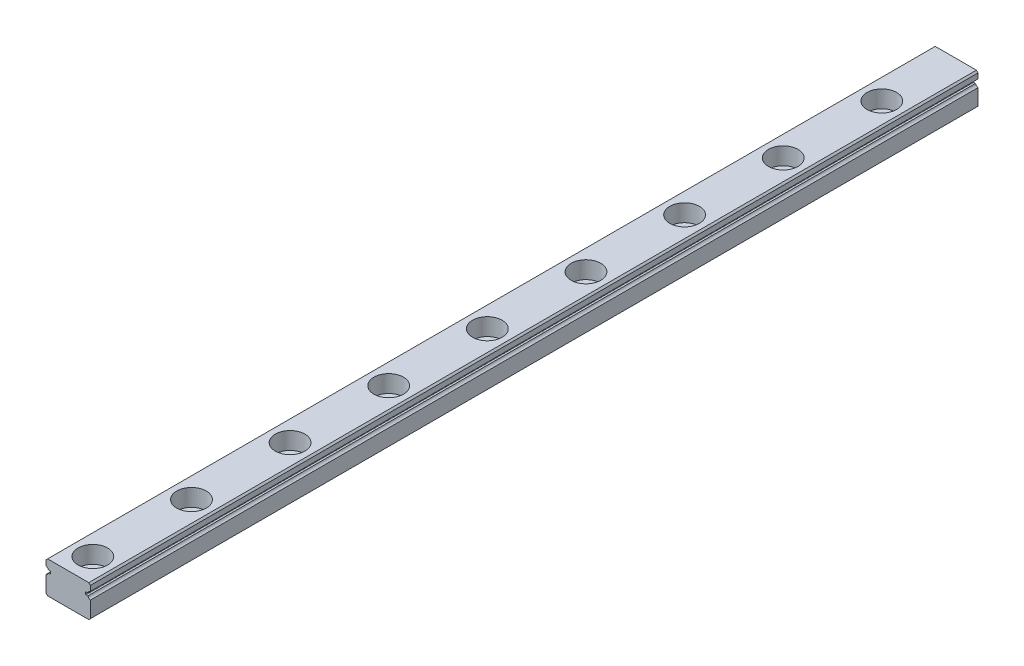
from build123d import *

# Parameters (mm, degrees)
EXTRUDE_1_DEPTH              = 180
HOLE_WIZARD_M2_1_D           = 2.4
HOLE_WIZARD_M2_1_CBORE_D     = 6
HOLE_WIZARD_M2_1_CBORE_DEPTH = 3.5
PATTERN_LINEAR_1_COUNT       = 9
PATTERN_LINEAR_1_PITCH       = 20


with BuildPart() as part:
    # 草图1 → 凸台-拉伸1 (new body)
    with BuildSketch(Plane.XY):
        with BuildLine():
            Line((-4.5, -2.905269119), (-4.5, -6.175269119))
            Line((-4.5, -6.175269119), (-4.174730881, -6.500538239))
            Line((-4.174730881, -6.500538239), (0, -6.500538239))
            Line((0, -6.500538239), (4.174730881, -6.500538239))
            Line((4.174730881, -6.500538239), (4.5, -6.175269119))
            Line((4.5, -6.175269119), (4.5, -2.905269119))
            ThreePointArc((4.5, -2.905269119), (4.188070601, -2.722678698), (3.990111871, -2.420269119))
            Line((3.990111871, -2.420269119), (3.630111871, -2.420269119))
            ThreePointArc((3.630111871, -2.420269119), (3.566472261, -2.39390873), (3.540111871, -2.330269119))
            Line((3.540111871, -2.330269119), (3.540111871, -1.970269119))
            ThreePointArc((3.540111871, -1.970269119), (3.566472261, -1.906629509), (3.630111871, -1.880269119))
            Line((3.630111871, -1.880269119), (3.990111871, -1.880269119))
            ThreePointArc((3.990111871, -1.880269119), (4.188070601, -1.577859541), (4.5, -1.395269119))
            Line((4.5, -1.395269119), (4.5, -0.325269119))
            Line((4.5, -0.325269119), (4.174730881, 0))
            Line((4.174730881, 0), (0, 0))
            Line((0, 0), (-4.174730881, 0))
            Line((-4.174730881, 0), (-4.5, -0.325269119))
            Line((-4.5, -0.325269119), (-4.5, -1.395269119))
            ThreePointArc((-4.5, -1.395269119), (-4.188070601, -1.577859541), (-3.990111871, -1.880269119))
            Line((-3.990111871, -1.880269119), (-3.630111871, -1.880269119))
            ThreePointArc((-3.630111871, -1.880269119), (-3.566472261, -1.906629509), (-3.540111871, -1.970269119))
            Line((-3.540111871, -1.970269119), (-3.540111871, -2.330269119))
            ThreePointArc((-3.540111871, -2.330269119), (-3.566472261, -2.39390873), (-3.630111871, -2.420269119))
            Line((-3.630111871, -2.420269119), (-3.990111871, -2.420269119))
            ThreePointArc((-3.990111871, -2.420269119), (-4.188070601, -2.722678698), (-4.5, -2.905269119))
        make_face()
    extrude(amount=EXTRUDE_1_DEPTH)

    # M2 六角头螺栓的柱形沉头孔1 (through all)
    with Locations(Plane(origin=(0, 0, 0), x_dir=(1, 0, 0), z_dir=(0, 1, 0))):
        with Locations((0, -175)):
            hole_wizard_m2_1 = CounterBoreHole(HOLE_WIZARD_M2_1_D / 2, HOLE_WIZARD_M2_1_CBORE_D / 2, HOLE_WIZARD_M2_1_CBORE_DEPTH)

    # 阵列(线性)1: M2 六角头螺栓的柱形沉头孔1 ×9
    with Locations(*[(0, 0, -i * PATTERN_LINEAR_1_PITCH) for i in range(1, PATTERN_LINEAR_1_COUNT)]):
        add(hole_wizard_m2_1, mode=Mode.SUBTRACT)


solid = part.part
